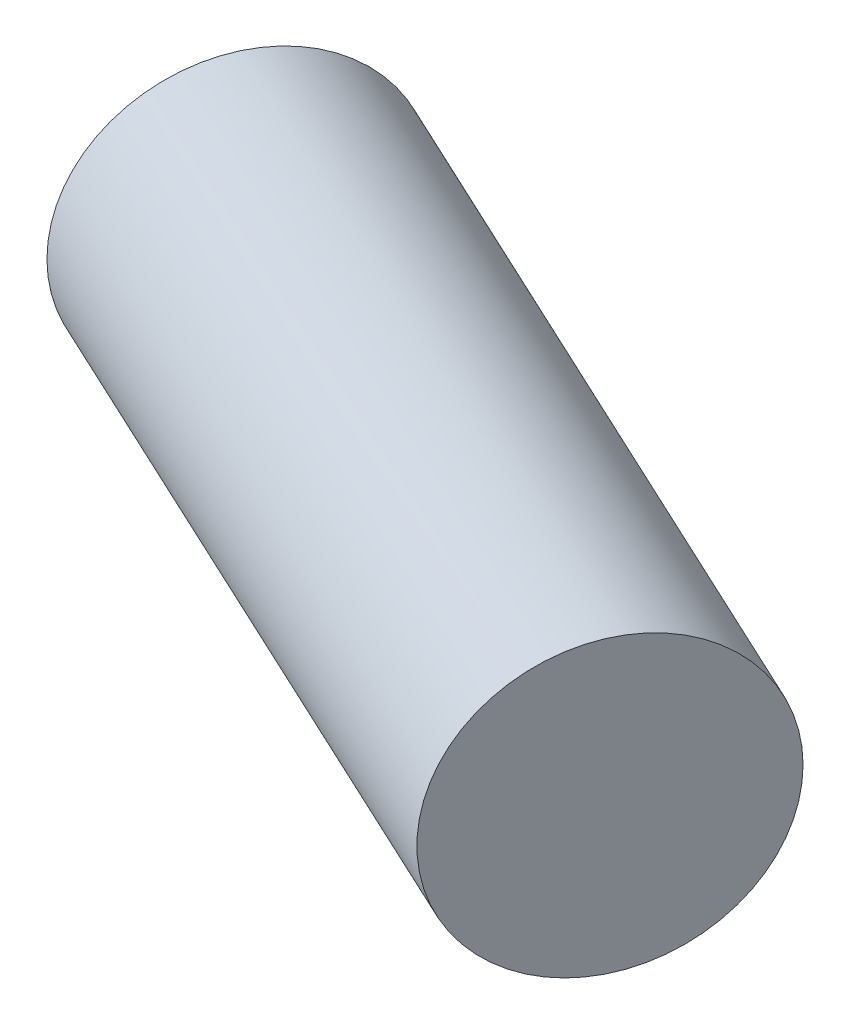
from build123d import *

# Parameters (mm, degrees)
SKETCH1_R           = 1.5
BOSS_EXTRUDE1_DEPTH = 7.89575828


with BuildPart() as part:
    # Sketch1 → Boss-Extrude1 (new body)
    with BuildSketch(Plane(origin=(3.577993607, 0, 1.66844582), x_dir=(0.42261826174070866, 6.523089282898395e-15, -0.9063077870366457), z_dir=(0.9063077870366457, 1.3988810110276972e-14, 0.42261826174070866))):
        with Locations((-63.062021603, 101.496948087)):
            Circle(SKETCH1_R)
    extrude(amount=-BOSS_EXTRUDE1_DEPTH)


solid = part.part
